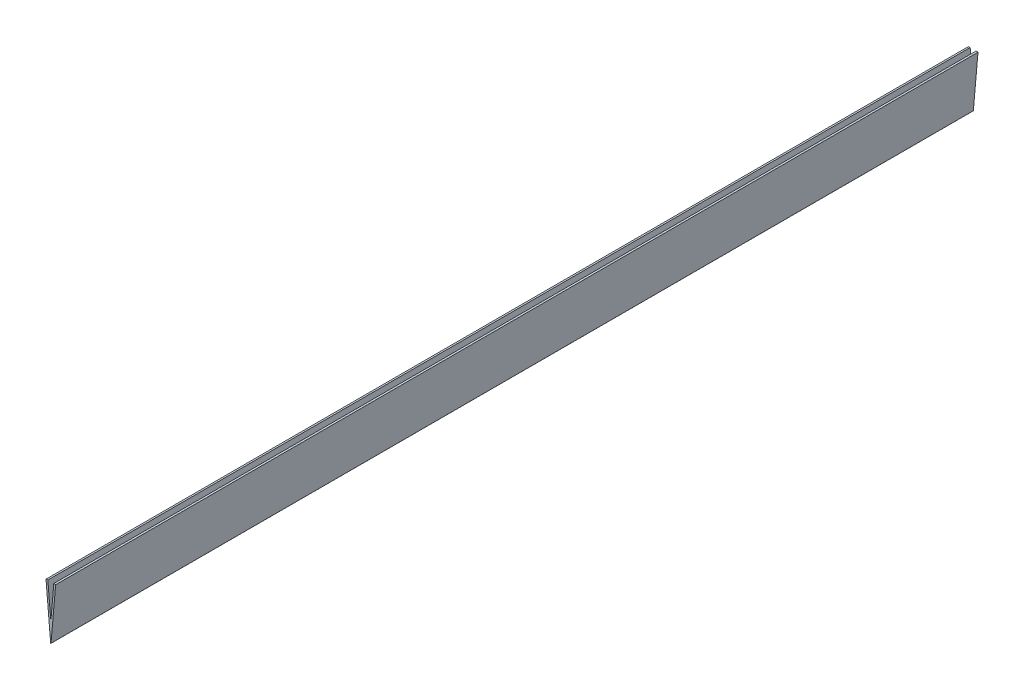
from build123d import *

# Parameters (mm, degrees)
BOSS_EXTRUDE1_DEPTH = 50
FILLET1_R           = 0.01


with BuildPart() as part:
    # Sketch1 → Boss-Extrude1 (new body)
    with BuildSketch(Plane.XY):
        Polygon((0, 0), (0.161847758, 1.849928344), (0.261467228, 1.84121277), (0, -1.147371325), (-0.261467228, 1.84121277), (-0.161847758, 1.849928344), align=None)
    extrude(amount=BOSS_EXTRUDE1_DEPTH)

    # Fillet1
    fillet1_edges = [part.edges().sort_by_distance(p)[0] for p in [
        (0, 0, 25),
        (0, -1.147371325, 25),
    ]]
    fillet(fillet1_edges, radius=FILLET1_R)


solid = part.part
